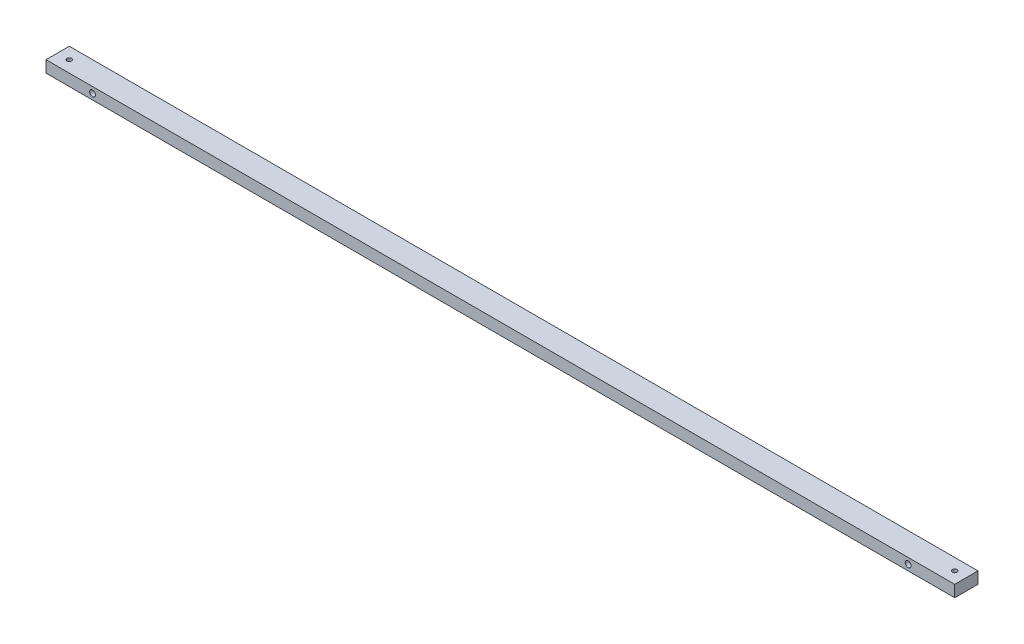
from build123d import *

# Parameters (mm, degrees)
SKETCH1_W                   = 25.4
SKETCH1_H                   = 12.7
BOSS_EXTRUDE1_DEPTH         = 990.6
F_1_4_20_TAPPED_HOLE1_D     = 5.1054
F_1_4_0_25_DIAMETER_HOLE1_D = 6.35


with BuildPart() as part:
    # Sketch1 → Boss-Extrude1 (new body)
    with BuildSketch(Plane(origin=(0, 0, 0), x_dir=(0, 0, -1), z_dir=(1, 0, 0))):
        with Locations((12.7, 6.35)):
            Rectangle(SKETCH1_W, SKETCH1_H)
    extrude(amount=BOSS_EXTRUDE1_DEPTH)

    # 1/4-20 Tapped Hole1 (through all)
    with Locations(Plane(origin=(0, 12.7, 0), x_dir=(1, 0, 0), z_dir=(0, 1, 0))):
        with Locations((12.7, 12.7), (977.9, 12.7)):
            Hole(F_1_4_20_TAPPED_HOLE1_D / 2)

    # 1/4 (0.25) Diameter Hole1 (through all)
    with Locations(Plane(origin=(0, 0, -25.4), x_dir=(-1, 0, 0), z_dir=(0, 0, -1))):
        with Locations((-939.8, 6.35), (-50.8, 6.35)):
            Hole(F_1_4_0_25_DIAMETER_HOLE1_D / 2)


solid = part.part
